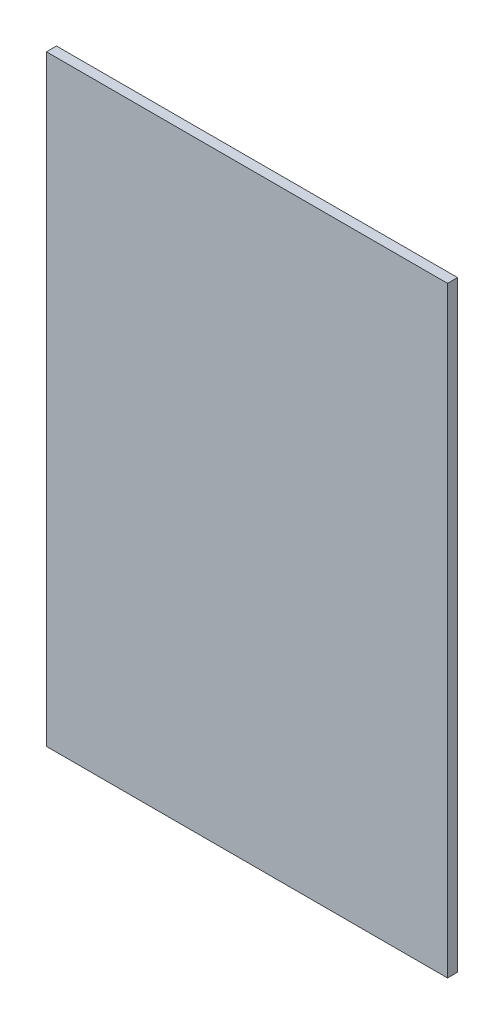
from build123d import *

# Parameters (mm, degrees)
ESQUISSE1_W        = 200
ESQUISSE1_H        = 300
BOSS_EXTRU_1_DEPTH = 5


with BuildPart() as part:
    # Esquisse1 → Boss.-Extru.1 (new body)
    with BuildSketch(Plane.XY):
        with Locations((100, 59.79020979)):
            Rectangle(ESQUISSE1_W, ESQUISSE1_H)
    extrude(amount=BOSS_EXTRU_1_DEPTH)


solid = part.part
